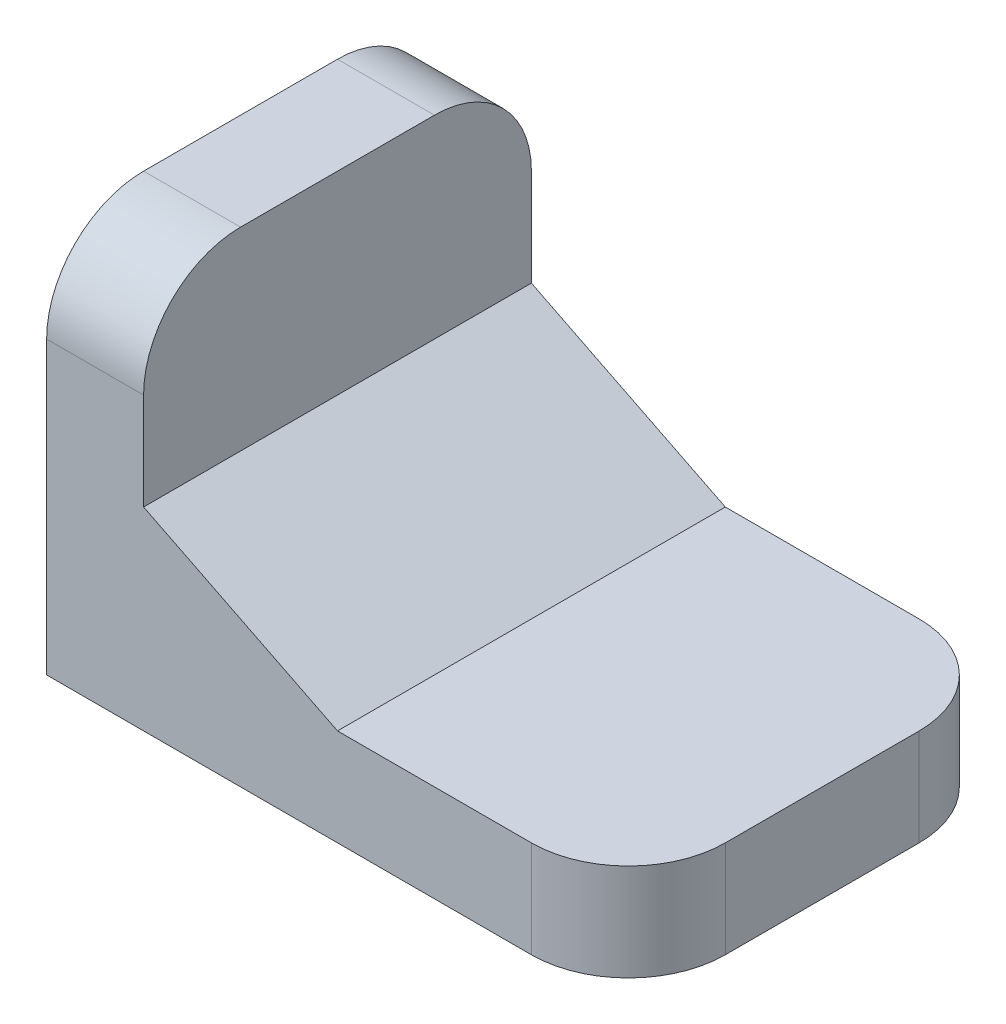
from build123d import *

# Parameters (mm, degrees)
EXTRUDE_1_DEPTH = 20
FILLET_1_R      = 5


with BuildPart() as part:
    # 草圖1 → 填料-伸長1 (new body)
    with BuildSketch(Plane.XY):
        Polygon((5, 10), (15, 5), (30, 5), (30, 0), (0, 0), (0, 20), (5, 20), align=None)
    extrude(amount=EXTRUDE_1_DEPTH)

    # 圓角1
    fillet_1_edges = [part.edges().sort_by_distance(p)[0] for p in [
        (2.5, 20, 20),
        (30, 2.5, 20),
        (2.5, 20, 0),
        (30, 2.5, 0),
    ]]
    fillet(fillet_1_edges, radius=FILLET_1_R)


solid = part.part
